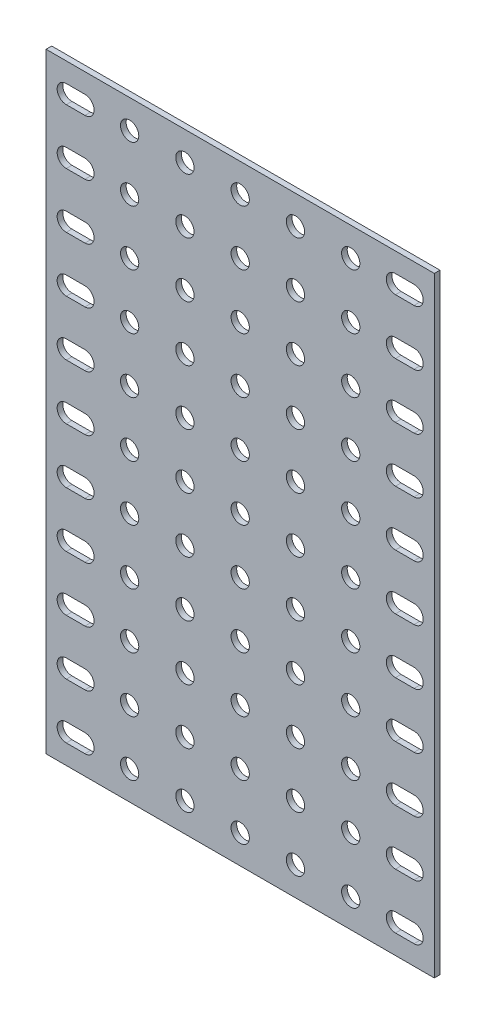
from build123d import *

# Parameters (mm, degrees)
SKETCH1_W           = 89.62
SKETCH1_H           = 140.86
SKETCH1_R           = 2.11
BOSS_EXTRUDE1_DEPTH = 1.3


with BuildPart() as part:
    # Sketch1 → Boss-Extrude1 (new body)
    with BuildSketch(Plane.XY):
        with Locations((25.52, -63.8)):
            Rectangle(SKETCH1_W, SKETCH1_H)
        Circle(SKETCH1_R, mode=Mode.SUBTRACT)
        with Locations((12.76, 0)):
            Circle(SKETCH1_R, mode=Mode.SUBTRACT)
        with Locations((25.52, 0)):
            Circle(SKETCH1_R, mode=Mode.SUBTRACT)
        with Locations((38.28, 0)):
            Circle(SKETCH1_R, mode=Mode.SUBTRACT)
        with Locations((51.04, 0)):
            Circle(SKETCH1_R, mode=Mode.SUBTRACT)
        with Locations((12.76, -12.76)):
            Circle(SKETCH1_R, mode=Mode.SUBTRACT)
        with Locations((25.52, -12.76)):
            Circle(SKETCH1_R, mode=Mode.SUBTRACT)
        with Locations((38.28, -12.76)):
            Circle(SKETCH1_R, mode=Mode.SUBTRACT)
        with Locations((51.04, -12.76)):
            Circle(SKETCH1_R, mode=Mode.SUBTRACT)
        with Locations((12.76, -25.52)):
            Circle(SKETCH1_R, mode=Mode.SUBTRACT)
        with Locations((25.52, -25.52)):
            Circle(SKETCH1_R, mode=Mode.SUBTRACT)
        with Locations((38.28, -25.52)):
            Circle(SKETCH1_R, mode=Mode.SUBTRACT)
        with Locations((51.04, -25.52)):
            Circle(SKETCH1_R, mode=Mode.SUBTRACT)
        with Locations((12.76, -38.28)):
            Circle(SKETCH1_R, mode=Mode.SUBTRACT)
        with Locations((25.52, -38.28)):
            Circle(SKETCH1_R, mode=Mode.SUBTRACT)
        with Locations((38.28, -38.28)):
            Circle(SKETCH1_R, mode=Mode.SUBTRACT)
        with Locations((51.04, -38.28)):
            Circle(SKETCH1_R, mode=Mode.SUBTRACT)
        with Locations((12.76, -51.04)):
            Circle(SKETCH1_R, mode=Mode.SUBTRACT)
        with Locations((25.52, -51.04)):
            Circle(SKETCH1_R, mode=Mode.SUBTRACT)
        with Locations((38.28, -51.04)):
            Circle(SKETCH1_R, mode=Mode.SUBTRACT)
        with Locations((51.04, -51.04)):
            Circle(SKETCH1_R, mode=Mode.SUBTRACT)
        with Locations((12.76, -63.8)):
            Circle(SKETCH1_R, mode=Mode.SUBTRACT)
        with Locations((25.52, -63.8)):
            Circle(SKETCH1_R, mode=Mode.SUBTRACT)
        with Locations((38.28, -63.8)):
            Circle(SKETCH1_R, mode=Mode.SUBTRACT)
        with Locations((51.04, -63.8)):
            Circle(SKETCH1_R, mode=Mode.SUBTRACT)
        with Locations((12.76, -76.56)):
            Circle(SKETCH1_R, mode=Mode.SUBTRACT)
        with Locations((25.52, -76.56)):
            Circle(SKETCH1_R, mode=Mode.SUBTRACT)
        with Locations((38.28, -76.56)):
            Circle(SKETCH1_R, mode=Mode.SUBTRACT)
        with Locations((51.04, -76.56)):
            Circle(SKETCH1_R, mode=Mode.SUBTRACT)
        with Locations((12.76, -89.32)):
            Circle(SKETCH1_R, mode=Mode.SUBTRACT)
        with Locations((25.52, -89.32)):
            Circle(SKETCH1_R, mode=Mode.SUBTRACT)
        with Locations((38.28, -89.32)):
            Circle(SKETCH1_R, mode=Mode.SUBTRACT)
        with Locations((51.04, -89.32)):
            Circle(SKETCH1_R, mode=Mode.SUBTRACT)
        with Locations((12.76, -102.08)):
            Circle(SKETCH1_R, mode=Mode.SUBTRACT)
        with Locations((25.52, -102.08)):
            Circle(SKETCH1_R, mode=Mode.SUBTRACT)
        with Locations((38.28, -102.08)):
            Circle(SKETCH1_R, mode=Mode.SUBTRACT)
        with Locations((51.04, -102.08)):
            Circle(SKETCH1_R, mode=Mode.SUBTRACT)
        with Locations((12.76, -114.84)):
            Circle(SKETCH1_R, mode=Mode.SUBTRACT)
        with Locations((25.52, -114.84)):
            Circle(SKETCH1_R, mode=Mode.SUBTRACT)
        with Locations((38.28, -114.84)):
            Circle(SKETCH1_R, mode=Mode.SUBTRACT)
        with Locations((51.04, -114.84)):
            Circle(SKETCH1_R, mode=Mode.SUBTRACT)
        with Locations((12.76, -127.6)):
            Circle(SKETCH1_R, mode=Mode.SUBTRACT)
        with Locations((25.52, -127.6)):
            Circle(SKETCH1_R, mode=Mode.SUBTRACT)
        with Locations((38.28, -127.6)):
            Circle(SKETCH1_R, mode=Mode.SUBTRACT)
        with Locations((51.04, -127.6)):
            Circle(SKETCH1_R, mode=Mode.SUBTRACT)
        with Locations((0, -12.76)):
            Circle(SKETCH1_R, mode=Mode.SUBTRACT)
        with Locations((0, -25.52)):
            Circle(SKETCH1_R, mode=Mode.SUBTRACT)
        with Locations((0, -38.28)):
            Circle(SKETCH1_R, mode=Mode.SUBTRACT)
        with Locations((0, -51.04)):
            Circle(SKETCH1_R, mode=Mode.SUBTRACT)
        with Locations((0, -63.8)):
            Circle(SKETCH1_R, mode=Mode.SUBTRACT)
        with Locations((0, -76.56)):
            Circle(SKETCH1_R, mode=Mode.SUBTRACT)
        with Locations((0, -89.32)):
            Circle(SKETCH1_R, mode=Mode.SUBTRACT)
        with Locations((0, -102.08)):
            Circle(SKETCH1_R, mode=Mode.SUBTRACT)
        with Locations((0, -114.84)):
            Circle(SKETCH1_R, mode=Mode.SUBTRACT)
        with Locations((0, -127.6)):
            Circle(SKETCH1_R, mode=Mode.SUBTRACT)
        with BuildLine():
            Line((61.36, 2.11), (65.66, 2.11))
            ThreePointArc((65.66, 2.11), (67.77, 0), (65.66, -2.11))
            Line((65.66, -2.11), (61.36, -2.11))
            ThreePointArc((61.36, -2.11), (59.25, 0), (61.36, 2.11))
        make_face(mode=Mode.SUBTRACT)
        with BuildLine():
            Line((61.36, -10.65), (65.66, -10.65))
            ThreePointArc((65.66, -10.65), (67.77, -12.76), (65.66, -14.87))
            Line((65.66, -14.87), (61.36, -14.87))
            ThreePointArc((61.36, -14.87), (59.25, -12.76), (61.36, -10.65))
        make_face(mode=Mode.SUBTRACT)
        with BuildLine():
            Line((61.36, -23.41), (65.66, -23.41))
            ThreePointArc((65.66, -23.41), (67.77, -25.52), (65.66, -27.63))
            Line((65.66, -27.63), (61.36, -27.63))
            ThreePointArc((61.36, -27.63), (59.25, -25.52), (61.36, -23.41))
        make_face(mode=Mode.SUBTRACT)
        with BuildLine():
            Line((61.36, -36.17), (65.66, -36.17))
            ThreePointArc((65.66, -36.17), (67.77, -38.28), (65.66, -40.39))
            Line((65.66, -40.39), (61.36, -40.39))
            ThreePointArc((61.36, -40.39), (59.25, -38.28), (61.36, -36.17))
        make_face(mode=Mode.SUBTRACT)
        with BuildLine():
            Line((61.36, -48.93), (65.66, -48.93))
            ThreePointArc((65.66, -48.93), (67.77, -51.04), (65.66, -53.15))
            Line((65.66, -53.15), (61.36, -53.15))
            ThreePointArc((61.36, -53.15), (59.25, -51.04), (61.36, -48.93))
        make_face(mode=Mode.SUBTRACT)
        with BuildLine():
            Line((61.36, -61.69), (65.66, -61.69))
            ThreePointArc((65.66, -61.69), (67.77, -63.8), (65.66, -65.91))
            Line((65.66, -65.91), (61.36, -65.91))
            ThreePointArc((61.36, -65.91), (59.25, -63.8), (61.36, -61.69))
        make_face(mode=Mode.SUBTRACT)
        with BuildLine():
            Line((61.36, -74.45), (65.66, -74.45))
            ThreePointArc((65.66, -74.45), (67.77, -76.56), (65.66, -78.67))
            Line((65.66, -78.67), (61.36, -78.67))
            ThreePointArc((61.36, -78.67), (59.25, -76.56), (61.36, -74.45))
        make_face(mode=Mode.SUBTRACT)
        with BuildLine():
            Line((61.36, -87.21), (65.66, -87.21))
            ThreePointArc((65.66, -87.21), (67.77, -89.32), (65.66, -91.43))
            Line((65.66, -91.43), (61.36, -91.43))
            ThreePointArc((61.36, -91.43), (59.25, -89.32), (61.36, -87.21))
        make_face(mode=Mode.SUBTRACT)
        with BuildLine():
            Line((61.36, -99.97), (65.66, -99.97))
            ThreePointArc((65.66, -99.97), (67.77, -102.08), (65.66, -104.19))
            Line((65.66, -104.19), (61.36, -104.19))
            ThreePointArc((61.36, -104.19), (59.25, -102.08), (61.36, -99.97))
        make_face(mode=Mode.SUBTRACT)
        with BuildLine():
            Line((61.36, -112.73), (65.66, -112.73))
            ThreePointArc((65.66, -112.73), (67.77, -114.84), (65.66, -116.95))
            Line((65.66, -116.95), (61.36, -116.95))
            ThreePointArc((61.36, -116.95), (59.25, -114.84), (61.36, -112.73))
        make_face(mode=Mode.SUBTRACT)
        with BuildLine():
            Line((61.36, -125.49), (65.66, -125.49))
            ThreePointArc((65.66, -125.49), (67.77, -127.6), (65.66, -129.71))
            Line((65.66, -129.71), (61.36, -129.71))
            ThreePointArc((61.36, -129.71), (59.25, -127.6), (61.36, -125.49))
        make_face(mode=Mode.SUBTRACT)
        with BuildLine():
            Line((-10.32, 2.11), (-14.62, 2.11))
            ThreePointArc((-14.62, 2.11), (-16.73, 0), (-14.62, -2.11))
            Line((-14.62, -2.11), (-10.32, -2.11))
            ThreePointArc((-10.32, -2.11), (-8.21, 0), (-10.32, 2.11))
        make_face(mode=Mode.SUBTRACT)
        with BuildLine():
            Line((-10.32, -10.65), (-14.62, -10.65))
            ThreePointArc((-14.62, -10.65), (-16.73, -12.76), (-14.62, -14.87))
            Line((-14.62, -14.87), (-10.32, -14.87))
            ThreePointArc((-10.32, -14.87), (-8.21, -12.76), (-10.32, -10.65))
        make_face(mode=Mode.SUBTRACT)
        with BuildLine():
            Line((-10.32, -23.41), (-14.62, -23.41))
            ThreePointArc((-14.62, -23.41), (-16.73, -25.52), (-14.62, -27.63))
            Line((-14.62, -27.63), (-10.32, -27.63))
            ThreePointArc((-10.32, -27.63), (-8.21, -25.52), (-10.32, -23.41))
        make_face(mode=Mode.SUBTRACT)
        with BuildLine():
            Line((-10.32, -36.17), (-14.62, -36.17))
            ThreePointArc((-14.62, -36.17), (-16.73, -38.28), (-14.62, -40.39))
            Line((-14.62, -40.39), (-10.32, -40.39))
            ThreePointArc((-10.32, -40.39), (-8.21, -38.28), (-10.32, -36.17))
        make_face(mode=Mode.SUBTRACT)
        with BuildLine():
            Line((-10.32, -48.93), (-14.62, -48.93))
            ThreePointArc((-14.62, -48.93), (-16.73, -51.04), (-14.62, -53.15))
            Line((-14.62, -53.15), (-10.32, -53.15))
            ThreePointArc((-10.32, -53.15), (-8.21, -51.04), (-10.32, -48.93))
        make_face(mode=Mode.SUBTRACT)
        with BuildLine():
            Line((-10.32, -61.69), (-14.62, -61.69))
            ThreePointArc((-14.62, -61.69), (-16.73, -63.8), (-14.62, -65.91))
            Line((-14.62, -65.91), (-10.32, -65.91))
            ThreePointArc((-10.32, -65.91), (-8.21, -63.8), (-10.32, -61.69))
        make_face(mode=Mode.SUBTRACT)
        with BuildLine():
            Line((-10.32, -74.45), (-14.62, -74.45))
            ThreePointArc((-14.62, -74.45), (-16.73, -76.56), (-14.62, -78.67))
            Line((-14.62, -78.67), (-10.32, -78.67))
            ThreePointArc((-10.32, -78.67), (-8.21, -76.56), (-10.32, -74.45))
        make_face(mode=Mode.SUBTRACT)
        with BuildLine():
            Line((-10.32, -87.21), (-14.62, -87.21))
            ThreePointArc((-14.62, -87.21), (-16.73, -89.32), (-14.62, -91.43))
            Line((-14.62, -91.43), (-10.32, -91.43))
            ThreePointArc((-10.32, -91.43), (-8.21, -89.32), (-10.32, -87.21))
        make_face(mode=Mode.SUBTRACT)
        with BuildLine():
            Line((-10.32, -99.97), (-14.62, -99.97))
            ThreePointArc((-14.62, -99.97), (-16.73, -102.08), (-14.62, -104.19))
            Line((-14.62, -104.19), (-10.32, -104.19))
            ThreePointArc((-10.32, -104.19), (-8.21, -102.08), (-10.32, -99.97))
        make_face(mode=Mode.SUBTRACT)
        with BuildLine():
            Line((-10.32, -112.73), (-14.62, -112.73))
            ThreePointArc((-14.62, -112.73), (-16.73, -114.84), (-14.62, -116.95))
            Line((-14.62, -116.95), (-10.32, -116.95))
            ThreePointArc((-10.32, -116.95), (-8.21, -114.84), (-10.32, -112.73))
        make_face(mode=Mode.SUBTRACT)
        with BuildLine():
            Line((-10.32, -125.49), (-14.62, -125.49))
            ThreePointArc((-14.62, -125.49), (-16.73, -127.6), (-14.62, -129.71))
            Line((-14.62, -129.71), (-10.32, -129.71))
            ThreePointArc((-10.32, -129.71), (-8.21, -127.6), (-10.32, -125.49))
        make_face(mode=Mode.SUBTRACT)
    extrude(amount=BOSS_EXTRUDE1_DEPTH)


solid = part.part
